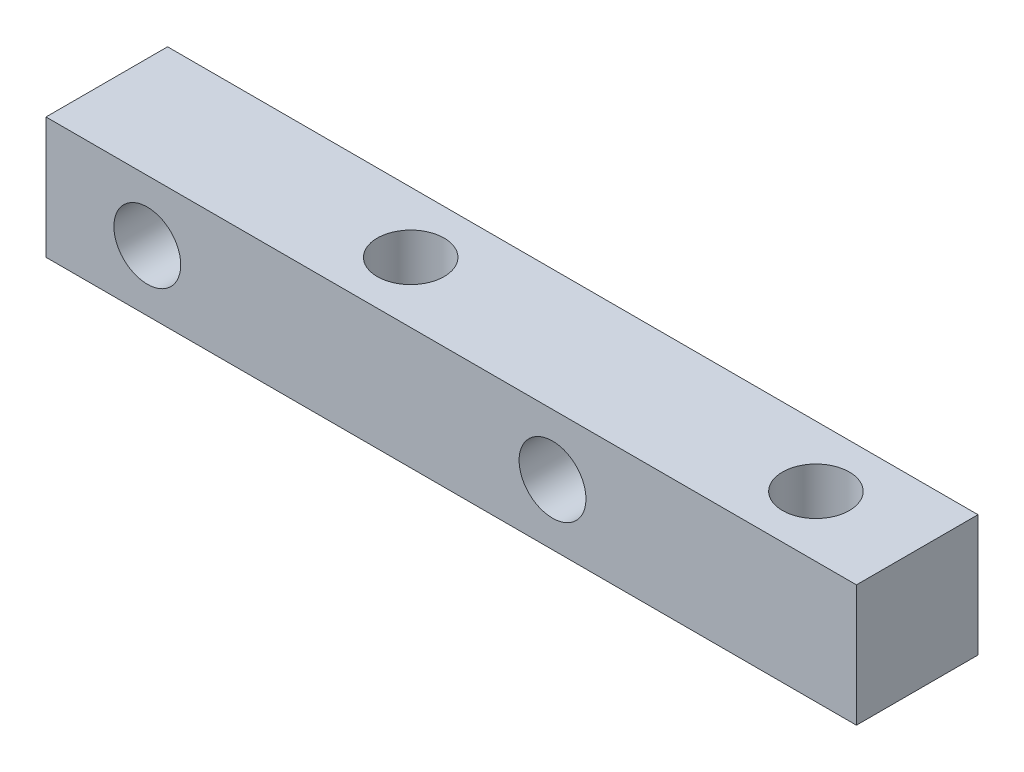
from build123d import *

# Parameters (mm, degrees)
SKETCH_1_W          = 6
SKETCH_1_H          = 6
EXTRUDE_1_DEPTH     = 40
SKETCH_2_R          = 1.65
CUT_EXTRUDE_1_DEPTH = 6
SKETCH_3_R          = 1.65
CUT_EXTRUDE_2_DEPTH = 6


with BuildPart() as part:
    # 草图1 → 凸台-拉伸1 (new body)
    with BuildSketch(Plane(origin=(0, 0, 0), x_dir=(0, 0, -1), z_dir=(1, 0, 0))):
        Rectangle(SKETCH_1_W, SKETCH_1_H)
    extrude(amount=EXTRUDE_1_DEPTH)

    # 草图2 → 切除-拉伸1 (cut)
    with BuildSketch(Plane.XY.offset(3)):
        with Locations((5, 0)):
            Circle(SKETCH_2_R)
        with Locations((25, 0)):
            Circle(SKETCH_2_R)
    extrude(amount=-CUT_EXTRUDE_1_DEPTH, mode=Mode.SUBTRACT)

    # 草图3 → 切除-拉伸2 (cut)
    with BuildSketch(Plane(origin=(0, 3, 0), x_dir=(1, 0, 0), z_dir=(0, 1, 0))):
        with Locations(Location((15, 0, 0), (0, 0, 270))):
            Circle(SKETCH_3_R)
        with Locations(Location((35, 0, 0), (0, 0, 270))):
            Circle(SKETCH_3_R)
    extrude(amount=-CUT_EXTRUDE_2_DEPTH, mode=Mode.SUBTRACT)


solid = part.part
